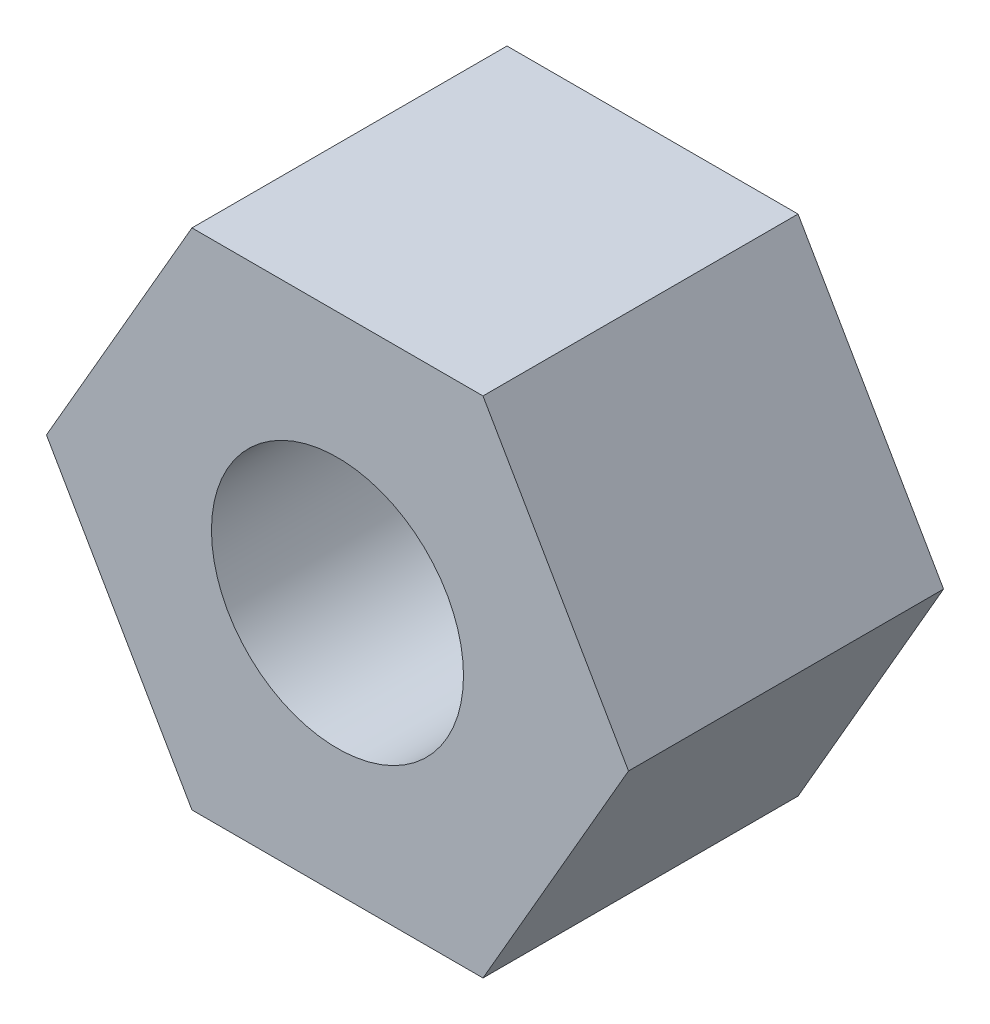
from build123d import *

# Parameters (mm, degrees)
BOSS_EXTRUDE1_DEPTH = 5
SKETCH2_R           = 2
CUT_EXTRUDE1_DEPTH  = 5


with BuildPart() as part:
    # Sketch1 → Boss-Extrude1 (new body)
    with BuildSketch(Plane.XY):
        Polygon((4.618802154, 0), (2.309401077, 4), (-2.309401077, 4), (-4.618802154, 0), (-2.309401077, -4), (2.309401077, -4), align=None)
    extrude(amount=BOSS_EXTRUDE1_DEPTH)

    # Sketch2 → Cut-Extrude1 (cut)
    with BuildSketch(Plane.XY.offset(5)):
        Circle(SKETCH2_R)
    extrude(amount=-CUT_EXTRUDE1_DEPTH, mode=Mode.SUBTRACT)


solid = part.part
